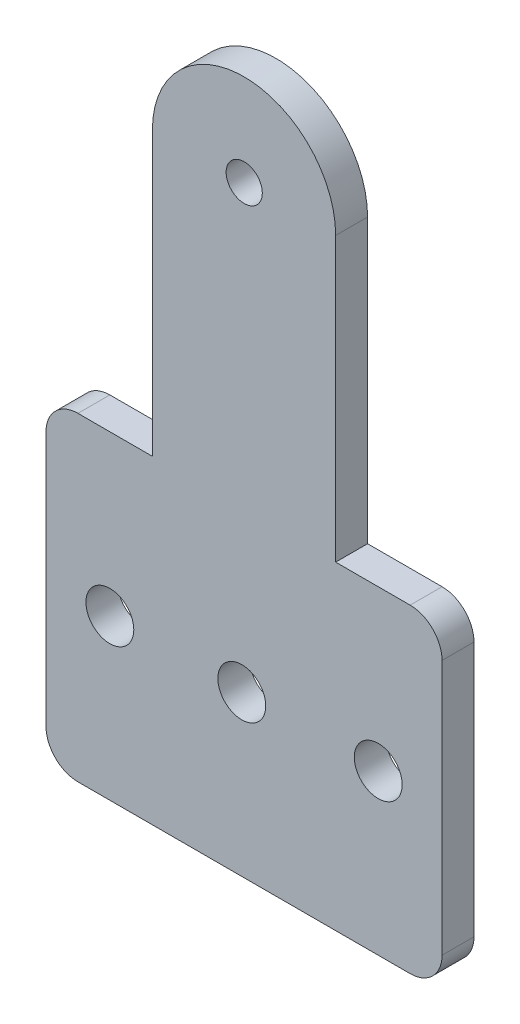
from build123d import *

# Parameters (mm, degrees)
BOSS_EXTRUDE1_DEPTH  = 3
M3_CLEARANCE_HOLE1_D = 3.4
M4_CLEARANCE_HOLE1_D = 4.5
FILLET1_R            = 3


with BuildPart() as part:
    # Sketch1 → Boss-Extrude1 (new body)
    with BuildSketch(Plane.XY):
        with BuildLine():
            Line((50.773782993, 15), (50.773782993, 41.5958))
            ThreePointArc((50.773782993, 41.5958), (59.386891497, 50.208908503), (68, 41.5958))
            Line((68, 41.5958), (68, 15))
            Line((68, 15), (78, 15))
            Line((78, 15), (78, -15))
            Line((78, -15), (40.773782993, -15))
            Line((40.773782993, -15), (40.773782993, 15))
            Line((40.773782993, 15), (50.773782993, 15))
        make_face()
    extrude(amount=BOSS_EXTRUDE1_DEPTH)

    # M3 Clearance Hole1 (through all)
    with Locations(Plane.XY.offset(3)):
        with Locations((59.40350934, 41.5958)):
            Hole(M3_CLEARANCE_HOLE1_D / 2)

    # M4 Clearance Hole1 (through all)
    with Locations(Plane.XY.offset(3)):
        with Locations((46.773782993, 0), (72, 0), (59.177120078, 0)):
            Hole(M4_CLEARANCE_HOLE1_D / 2)

    # Fillet1
    fillet1_edges = [part.edges().sort_by_distance(p)[0] for p in [
        (78, -15, 1.5),
        (40.773782993, -15, 1.5),
        (40.773782993, 15, 1.5),
        (78, 15, 1.5),
    ]]
    fillet(fillet1_edges, radius=FILLET1_R)


solid = part.part
